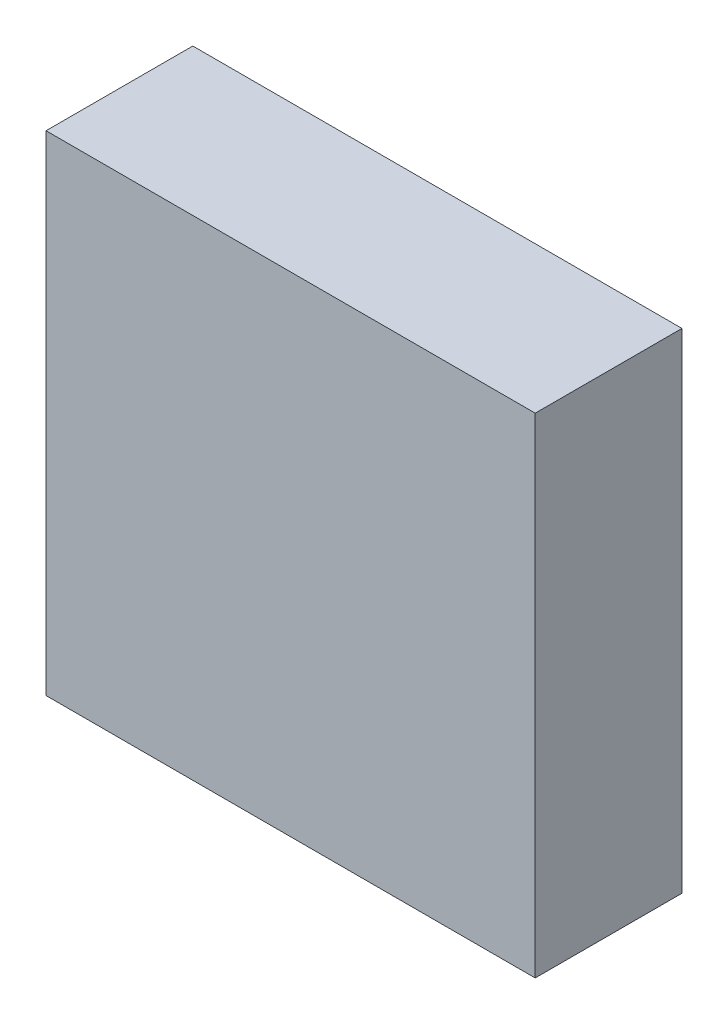
from build123d import *

# Parameters (mm, degrees)
SKETCH1_W           = 10
SKETCH1_H           = 10
BOSS_EXTRUDE1_DEPTH = 3


with BuildPart() as part:
    # Sketch1 → Boss-Extrude1 (new body)
    with BuildSketch(Plane.XY):
        with Locations((5, 5)):
            Rectangle(SKETCH1_W, SKETCH1_H)
    extrude(amount=BOSS_EXTRUDE1_DEPTH)


solid = part.part
